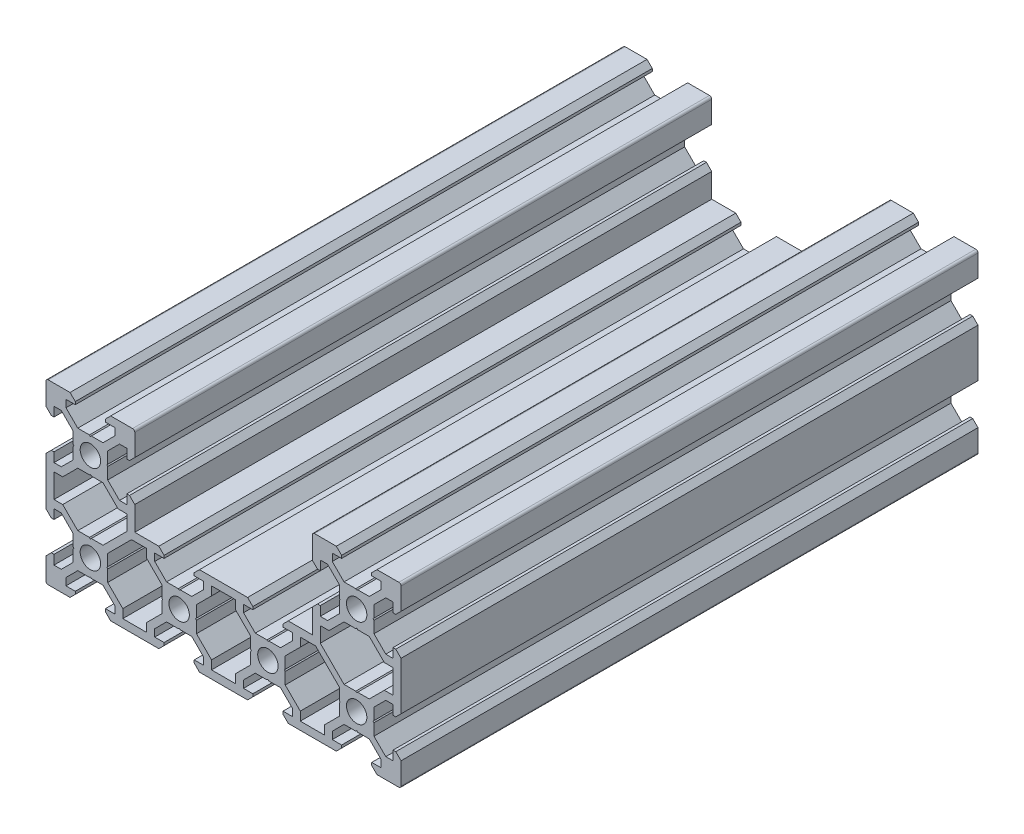
from build123d import *

# Parameters (mm, degrees)
ESQUISSE1_R             = 2.3
BOSS_EXTRU_1_DEPTH      = 130
ENL_V_MAT_EXTRU_1_DEPTH = 137.747943312


with BuildPart() as part:
    # Esquisse1 → Boss.-Extru.1 (new body)
    with BuildSketch(Plane.XY):
        with BuildLine():
            Line((-3.9, 2.839339828), (-6.560660172, 5.5))
            Line((-6.560660172, 5.5), (-8.2, 5.5))
            Line((-8.2, 5.5), (-8.2, 3.395))
            Line((-8.2, 3.395), (-8.815, 3.395))
            Line((-8.815, 3.395), (-10, 4.58))
            Line((-10, 4.58), (-10, 9.5))
            ThreePointArc((-10, 9.5), (-9.853553391, 9.853553391), (-9.5, 10))
            Line((-9.5, 10), (-4.58, 10))
            Line((-4.58, 10), (-3.395, 8.815))
            Line((-3.395, 8.815), (-3.395, 8.2))
            Line((-3.395, 8.2), (-5.5, 8.2))
            Line((-5.5, 8.2), (-5.5, 6.560660172))
            Line((-5.5, 6.560660172), (-2.839339828, 3.9))
            Line((-2.839339828, 3.9), (2.839339828, 3.9))
            Line((2.839339828, 3.9), (5.5, 6.560660172))
            Line((5.5, 6.560660172), (5.5, 8.2))
            Line((5.5, 8.2), (3.395, 8.2))
            Line((3.395, 8.2), (3.395, 8.815))
            Line((3.395, 8.815), (4.58, 10))
            Line((4.58, 10), (9.5, 10))
            ThreePointArc((9.5, 10), (9.853553391, 9.853553391), (10, 9.5))
            Line((10, 9.5), (10, 4.58))
            Line((10, 4.58), (8.815, 3.395))
            Line((8.815, 3.395), (8.2, 3.395))
            Line((8.2, 3.395), (8.2, 5.5))
            Line((8.2, 5.5), (6.560660172, 5.5))
            Line((6.560660172, 5.5), (3.9, 2.839339828))
            Line((3.9, 2.839339828), (3.9, -2.839339828))
            Line((3.9, -2.839339828), (6.560660172, -5.5))
            Line((6.560660172, -5.5), (8.2, -5.5))
            Line((8.2, -5.5), (8.2, -3.395))
            Line((8.2, -3.395), (8.815, -3.395))
            Line((8.815, -3.395), (10, -4.58))
            Line((10, -4.58), (10, -10))
            Line((10, -10), (15.42, -10))
            Line((15.42, -10), (16.605, -11.185))
            Line((16.605, -11.185), (16.605, -11.8))
            Line((16.605, -11.8), (14.5, -11.8))
            Line((14.5, -11.8), (14.5, -13.439339828))
            Line((14.5, -13.439339828), (17.160660172, -16.1))
            Line((17.160660172, -16.1), (22.839339828, -16.1))
            Line((22.839339828, -16.1), (25.5, -13.439339828))
            Line((25.5, -13.439339828), (25.5, -11.8))
            Line((25.5, -11.8), (23.395, -11.8))
            Line((23.395, -11.8), (23.395, -11.185))
            Line((23.395, -11.185), (24.58, -10))
            Line((24.58, -10), (30, -10))
            Line((30, -10), (30, -11.8))
            Line((30, -11.8), (27.3, -11.8))
            Line((27.3, -11.8), (27.3, -13.760660172))
            Line((27.3, -13.760660172), (23.9, -17.160660172))
            Line((23.9, -17.160660172), (23.9, -22.839339828))
            Line((23.9, -22.839339828), (27.3, -26.239339828))
            Line((27.3, -26.239339828), (27.3, -28.2))
            Line((27.3, -28.2), (30, -28.2))
            Line((30, -28.2), (30, -30))
            Line((30, -30), (24.58, -30))
            Line((24.58, -30), (23.395, -28.815))
            Line((23.395, -28.815), (23.395, -28.2))
            Line((23.395, -28.2), (25.5, -28.2))
            Line((25.5, -28.2), (25.5, -26.560660172))
            Line((25.5, -26.560660172), (22.839339828, -23.9))
            Line((22.839339828, -23.9), (17.160660172, -23.9))
            Line((17.160660172, -23.9), (14.5, -26.560660172))
            Line((14.5, -26.560660172), (14.5, -28.2))
            Line((14.5, -28.2), (16.605, -28.2))
            Line((16.605, -28.2), (16.605, -28.815))
            Line((16.605, -28.815), (15.42, -30))
            Line((15.42, -30), (4.58, -30))
            Line((4.58, -30), (3.395, -28.815))
            Line((3.395, -28.815), (3.395, -28.2))
            Line((3.395, -28.2), (5.5, -28.2))
            Line((5.5, -28.2), (5.5, -26.560660172))
            Line((5.5, -26.560660172), (2.839339828, -23.9))
            Line((2.839339828, -23.9), (-2.839339828, -23.9))
            Line((-2.839339828, -23.9), (-5.5, -26.560660172))
            Line((-5.5, -26.560660172), (-5.5, -28.2))
            Line((-5.5, -28.2), (-3.395, -28.2))
            Line((-3.395, -28.2), (-3.395, -28.815))
            Line((-3.395, -28.815), (-4.58, -30))
            Line((-4.58, -30), (-9.5, -30))
            ThreePointArc((-9.5, -30), (-9.853553391, -29.853553391), (-10, -29.5))
            Line((-10, -29.5), (-10, -24.58))
            Line((-10, -24.58), (-8.815, -23.395))
            Line((-8.815, -23.395), (-8.2, -23.395))
            Line((-8.2, -23.395), (-8.2, -25.5))
            Line((-8.2, -25.5), (-6.560660172, -25.5))
            Line((-6.560660172, -25.5), (-3.9, -22.839339828))
            Line((-3.9, -22.839339828), (-3.9, -17.160660172))
            Line((-3.9, -17.160660172), (-6.560660172, -14.5))
            Line((-6.560660172, -14.5), (-8.2, -14.5))
            Line((-8.2, -14.5), (-8.2, -16.605))
            Line((-8.2, -16.605), (-8.815, -16.605))
            Line((-8.815, -16.605), (-10, -15.42))
            Line((-10, -15.42), (-10, -4.58))
            Line((-10, -4.58), (-8.815, -3.395))
            Line((-8.815, -3.395), (-8.2, -3.395))
            Line((-8.2, -3.395), (-8.2, -5.5))
            Line((-8.2, -5.5), (-6.560660172, -5.5))
            Line((-6.560660172, -5.5), (-3.9, -2.839339828))
            Line((-3.9, -2.839339828), (-3.9, 2.839339828))
        make_face()
        Circle(ESQUISSE1_R, mode=Mode.SUBTRACT)
        with Locations(Location((0, -20, 0), (0, 0, 180))):
            Circle(ESQUISSE1_R, mode=Mode.SUBTRACT)
        with Locations(Location((20, -20, 0), (0, 0, 180))):
            Circle(ESQUISSE1_R, mode=Mode.SUBTRACT)
        Polygon((-2.839339828, -3.9), (-6.239339828, -7.3), (-8.2, -7.3), (-8.2, -12.7), (-6.239339828, -12.7), (-2.839339828, -16.1), (2.839339828, -16.1), (8.2, -10.739339828), (8.2, -7.3), (6.239339828, -7.3), (2.839339828, -3.9), align=None, mode=Mode.SUBTRACT)
        Polygon((3.9, -22.839339828), (7.3, -26.239339828), (7.3, -28.2), (12.7, -28.2), (12.7, -26.239339828), (16.1, -22.839339828), (16.1, -17.160660172), (12.7, -13.760660172), (12.7, -11.8), (9.260660172, -11.8), (3.9, -17.160660172), align=None, mode=Mode.SUBTRACT)
    boss_extru_1 = extrude(amount=BOSS_EXTRU_1_DEPTH)

    # Esquisse2 → Enlèv. mat.-Extru.1 (cut, through all)
    with BuildSketch(Plane.XY.offset(130)):
        Polygon((-0.21, 3.9), (0, 3.69), (0.21, 3.9), align=None)
        Polygon((3.9, -0.21), (3.9, 0.21), (3.69, 0), align=None)
        Polygon((0.21, -3.9), (0, -3.69), (-0.21, -3.9), align=None)
        Polygon((-3.9, 0.21), (-3.9, -0.21), (-3.69, 0), align=None)
        Polygon((-3.9, -20.21), (-3.69, -20), (-3.9, -19.79), align=None)
        Polygon((0.21, -16.1), (-0.21, -16.1), (0, -16.31), align=None)
        Polygon((3.9, -19.79), (3.69, -20), (3.9, -20.21), align=None)
        Polygon((-0.21, -23.9), (0.21, -23.9), (0, -23.69), align=None)
        Polygon((20.21, -23.9), (20, -23.69), (19.79, -23.9), align=None)
        Polygon((16.1, -19.79), (16.1, -20.21), (16.31, -20), align=None)
        Polygon((19.79, -16.1), (20, -16.31), (20.21, -16.1), align=None)
        Polygon((23.9, -20.21), (23.9, -19.79), (23.69, -20), align=None)
    enl_v_mat_extru_1 = extrude(amount=-ENL_V_MAT_EXTRU_1_DEPTH, mode=Mode.SUBTRACT)

    # Symétrie1: Boss.-Extru.1, Enlèv. mat.-Extru.1 across plane
    add(boss_extru_1.mirror(Plane(origin=(30, -10, 130), x_dir=(0, 0, 1), z_dir=(-1, 0, 0))))
    add(enl_v_mat_extru_1.mirror(Plane(origin=(30, -10, 130), x_dir=(0, 0, 1), z_dir=(-1, 0, 0))), mode=Mode.SUBTRACT)


solid = part.part
